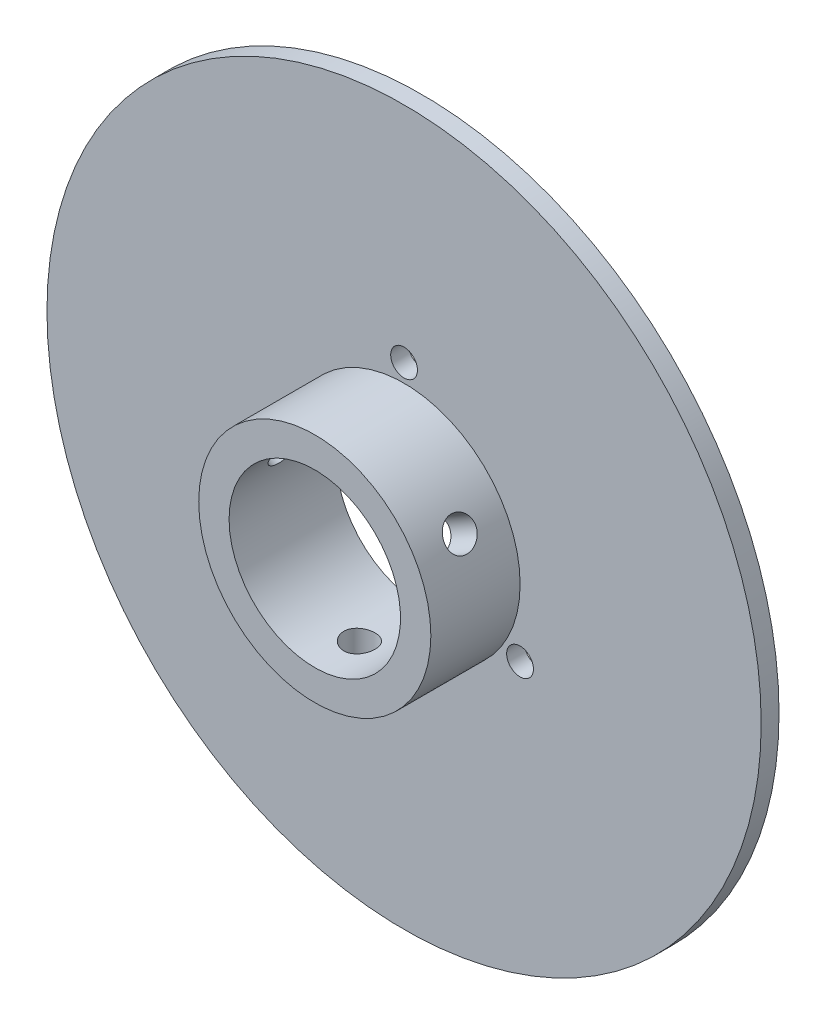
from build123d import *

# Parameters (mm, degrees)
SKETCH1_R           = 40
BOSS_EXTRUDE1_DEPTH = 2
SKETCH2_R           = 13
BOSS_EXTRUDE2_DEPTH = 10
SKETCH3_R           = 9.6
CUT_EXTRUDE1_DEPTH  = 58.827329179
SKETCH4_R           = 1.75
CUT_EXTRUDE2_DEPTH  = 58.827329179
CIRPATTERN1_COUNT   = 3
SKETCH5_R           = 1.5
CUT_EXTRUDE3_DEPTH  = 10
CIRPATTERN2_COUNT   = 3


with BuildPart() as part:
    # Sketch1 → Boss-Extrude1 (new body)
    with BuildSketch(Plane.XY):
        Circle(SKETCH1_R)
    extrude(amount=BOSS_EXTRUDE1_DEPTH)

    # Sketch2 → Boss-Extrude2 (add)
    with BuildSketch(Plane.XY.offset(2)):
        Circle(SKETCH2_R)
    extrude(amount=BOSS_EXTRUDE2_DEPTH)

    # Sketch3 → Cut-Extrude1 (cut, through all)
    with BuildSketch(Plane(origin=(0, 0, 0), x_dir=(-1, 0, 0), z_dir=(0, 0, -1))):
        Circle(SKETCH3_R)
    extrude(amount=-CUT_EXTRUDE1_DEPTH, mode=Mode.SUBTRACT)

    # Sketch4 → Cut-Extrude2 (cut, through all)
    with BuildSketch(Plane(origin=(0, 0, 0), x_dir=(1, 0, 0), z_dir=(0, 1, 0))):
        with Locations(Location((0, -7, 0), (0, 0, 270))):
            Circle(SKETCH4_R)
    cut_extrude2 = extrude(amount=-CUT_EXTRUDE2_DEPTH, mode=Mode.SUBTRACT)

    # CirPattern1: Cut-Extrude2 ×3 about axis
    cirpattern1_axis = Axis((0, 0, 12), (0, 0, -1))
    for i in range(1, CIRPATTERN1_COUNT):
        add(cut_extrude2.rotate(cirpattern1_axis, i * 360 / CIRPATTERN1_COUNT), mode=Mode.SUBTRACT)

    # Sketch5 → Cut-Extrude3 (cut)
    with BuildSketch(Plane(origin=(0, 0, 0), x_dir=(-1, 0, 0), z_dir=(0, 0, -1))):
        with Locations((12.990381057, -7.5)):
            Circle(SKETCH5_R)
    cut_extrude3 = extrude(amount=-CUT_EXTRUDE3_DEPTH, mode=Mode.SUBTRACT)

    # CirPattern2: Cut-Extrude3 ×3 about axis
    cirpattern2_axis = Axis((0, 0, 0), (0, 0, 1))
    for i in range(1, CIRPATTERN2_COUNT):
        add(cut_extrude3.rotate(cirpattern2_axis, i * 360 / CIRPATTERN2_COUNT), mode=Mode.SUBTRACT)


solid = part.part
